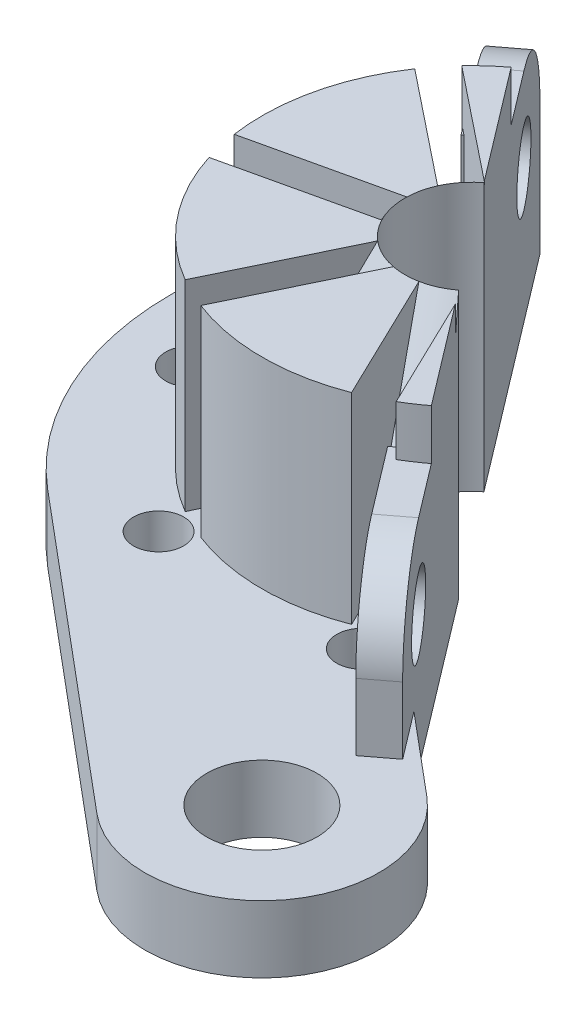
from build123d import *
from build123d.topology import SkipClean

# Parameters (mm, degrees)
SKETCH1_R           = 8.984375
SKETCH1_R_2         = 1.984375
SKETCH1_R_3         = 0.75
BOSS_EXTRUDE1_DEPTH = 2
SKETCH6_W           = 17.96875
SKETCH6_H           = 8
CUT_EXTRUDE1_DEPTH  = 16.014592511
BOSS_EXTRUDE3_START = -2
SKETCH7_R           = 1.65
BOSS_EXTRUDE3_DEPTH = 2
SKETCH8_R           = 1.1
BOSS_EXTRUDE4_DEPTH = 1


with BuildPart() as part:
    # Sketch1 → Boss-Extrude1 (new body)
    with BuildSketch(Plane(origin=(0, 0, 0), x_dir=(1, 0, 0), z_dir=(0, 1, 0))):
        with Locations(Location((0, 0, 0), (0, 0, 270))):
            Circle(SKETCH1_R)
        with Locations(Location((0, 0, 0), (0, 0, 270))):
            Circle(SKETCH1_R_2, mode=Mode.SUBTRACT)
        with Locations(Location((0, 7, 0), (0, 0, 270))):
            Circle(SKETCH1_R_3, mode=Mode.SUBTRACT)
        with Locations(Location((5.472820377, 4.364428613, 0), (0, 0, 270))):
            Circle(SKETCH1_R_3, mode=Mode.SUBTRACT)
        with Locations(Location((6.824495385, -1.557646538, 0), (0, 0, 270))):
            Circle(SKETCH1_R_3, mode=Mode.SUBTRACT)
        with Locations(Location((3.037186174, -6.306782075, 0), (0, 0, 270))):
            Circle(SKETCH1_R_3, mode=Mode.SUBTRACT)
        with Locations(Location((-3.037186174, -6.306782075, 0), (0, 0, 270))):
            Circle(SKETCH1_R_3, mode=Mode.SUBTRACT)
        with Locations(Location((-6.824495385, -1.557646538, 0), (0, 0, 270))):
            Circle(SKETCH1_R_3, mode=Mode.SUBTRACT)
        with Locations(Location((-5.472820377, 4.364428613, 0), (0, 0, 270))):
            Circle(SKETCH1_R_3, mode=Mode.SUBTRACT)
    extrude(amount=BOSS_EXTRUDE1_DEPTH)

    # Sweep1: sweep along a path in Sketch3
    with SkipClean():  # the faces are left unmerged after this step: merging them gives an invalid solid
        with BuildLine(Plane(origin=(0, 0, 0), x_dir=(0, 0, -1), z_dir=(1, 0, 0))) as sweep1_path:
            Line((0, 2), (0, 8))
        # Sketch2 → Sweep1 (sweep)
        with BuildSketch(Plane(origin=(0, 2, 0), x_dir=(1, 0, 0), z_dir=(0, 1, 0))):
            with BuildLine():
                Line((-0.5, 6.229967897), (-0.5, 1.920350005))
                ThreePointArc((-0.5, 1.920350005), (-0.860988045, 1.787860097), (-1.18964519, 1.588234385))
                Line((-1.18964519, 1.588234385), (-4.559040136, 4.275237191))
                ThreePointArc((-4.559040136, 4.275237191), (-2.711773369, 5.631055424), (-0.5, 6.229967897))
            make_face()
            with BuildLine():
                Line((0.5, 6.229967897), (0.5, 1.920350005))
                ThreePointArc((0.5, 1.920350005), (0.860988045, 1.787860097), (1.18964519, 1.588234385))
                Line((1.18964519, 1.588234385), (4.559040136, 4.275237191))
                ThreePointArc((4.559040136, 4.275237191), (2.711773369, 5.631055424), (0.5, 6.229967897))
            make_face()
            with BuildLine():
                Line((5.182529938, 3.493405709), (1.813134992, 0.806402903))
                ThreePointArc((1.813134992, 0.806402903), (1.934622576, 0.441564978), (1.983463288, 0.06014588))
                Line((1.983463288, 0.06014588), (6.185030062, -0.898834319))
                ThreePointArc((6.185030062, -0.898834319), (6.093299451, 1.390755837), (5.182529938, 3.493405709))
            make_face()
            with BuildLine():
                Line((5.962509128, -1.873762231), (1.760942354, -0.914782033))
                ThreePointArc((1.760942354, -0.914782033), (1.551446848, -1.237237576), (1.283693074, -1.5132337))
                Line((1.283693074, -1.5132337), (3.1535662, -5.396065254))
                ThreePointArc((3.1535662, -5.396065254), (4.886446765, -3.896811262), (5.962509128, -1.873762231))
            make_face()
            with BuildLine():
                Line((2.252597332, -5.829948993), (0.382724207, -1.947117439))
                ThreePointArc((0.382724207, -1.947117439), (0, -1.984375), (-0.382724207, -1.947117439))
                Line((-0.382724207, -1.947117439), (-2.252597332, -5.829948993))
                ThreePointArc((-2.252597332, -5.829948993), (0, -6.25), (2.252597332, -5.829948993))
            make_face()
            with BuildLine():
                Line((-3.1535662, -5.396065254), (-1.283693074, -1.5132337))
                ThreePointArc((-1.283693074, -1.5132337), (-1.551446848, -1.237237576), (-1.760942354, -0.914782033))
                Line((-1.760942354, -0.914782033), (-5.962509128, -1.873762231))
                ThreePointArc((-5.962509128, -1.873762231), (-4.886446765, -3.896811262), (-3.1535662, -5.396065254))
            make_face()
            with BuildLine():
                Line((-6.185030062, -0.898834319), (-1.983463288, 0.06014588))
                ThreePointArc((-1.983463288, 0.06014588), (-1.934622576, 0.441564978), (-1.813134992, 0.806402903))
                Line((-1.813134992, 0.806402903), (-5.182529938, 3.493405709))
                ThreePointArc((-5.182529938, 3.493405709), (-6.093299451, 1.390755837), (-6.185030062, -0.898834319))
            make_face()
        sweep(path=sweep1_path.line)

    # Sketch4 → Revolve1 (revolve)
    with SkipClean():  # the faces are left unmerged after this step: merging them gives an invalid solid
        with BuildSketch(Plane(origin=(0, 0, 0), x_dir=(0, 0, -1), z_dir=(1, 0, 0)), mode=Mode.PRIVATE) as revolve1_sk:
            Polygon((-5.396065254, 2), (-1.984375, 2), (-1.984375, 8), align=None)
        revolve(revolve1_sk.sketch.rotate(Axis((0, 0, 0), (0, 1, 0)), 165.405971265), axis=Axis((0, 0, 0), (0, 1, 0)))

    # Sketch6 → Cut-Extrude1 (cut, through all)
    with SkipClean():  # the faces are left unmerged after this step: merging them gives an invalid solid
        with BuildSketch(Plane(origin=(0, 0, 0), x_dir=(0.6052939880428899, 0, 0.7960020025346255), z_dir=(-0.7960020025346255, 0, 0.6052939880428899))):
            with Locations((0, 4)):
                Rectangle(SKETCH6_W, SKETCH6_H)
        extrude(amount=-CUT_EXTRUDE1_DEPTH, mode=Mode.SUBTRACT)

    # Sketch7 → Boss-Extrude3 (add)
    with SkipClean():  # the faces are left unmerged after this step: merging them gives an invalid solid
        with BuildSketch(Plane(origin=(0, 2, 0), x_dir=(1, 0, 0), z_dir=(0, 1, 0)).offset(BOSS_EXTRUDE3_START)):
            with BuildLine():
                Line((5.438188174, -7.151580492), (7.839492164, -9.165791707))
                ThreePointArc((7.839492164, -9.165791707), (8.271761308, -14.096627679), (3.340925335, -14.528896823))
                Line((3.340925335, -14.528896823), (-5.773830193, -6.883449647))
                ThreePointArc((-5.773830193, -6.883449647), (-0.214796249, -8.981806985), (5.438188174, -7.151580492))
            make_face()
            with Locations(Location((5.59020875, -11.847344265, 0), (0, 0, 270))):
                Circle(SKETCH7_R, mode=Mode.SUBTRACT)
        extrude(amount=BOSS_EXTRUDE3_DEPTH)

    # Sketch8 → Boss-Extrude4 (add)
    # profile 1 of 2: a face of its own
    with SkipClean():  # the faces are left unmerged after this step: merging them gives an invalid solid
        with BuildSketch(Plane(origin=(0, 0, 0), x_dir=(-0.60529398804289, 0, -0.7960020025346255), z_dir=(0.7960020025346254, 0, -0.6052939880428899))):
            with BuildLine():
                ThreePointArc((-8.25, 6.5), (-10.017766953, 5.767766953), (-10.75, 4))
                Line((-10.75, 4), (-10.75, 2))
                Line((-10.75, 2), (-5.75, 2))
                Line((-5.75, 2), (-5.75, 6.5))
                Line((-5.75, 6.5), (-8.25, 6.5))
            make_face()
            with Locations((-8.25, 4)):
                Circle(SKETCH8_R, mode=Mode.SUBTRACT)
        # profile 2 of 2: a face of its own
        with BuildSketch(Plane(origin=(0, 0, 0), x_dir=(-0.60529398804289, 0, -0.7960020025346255), z_dir=(0.7960020025346254, 0, -0.6052939880428899))):
            with BuildLine():
                Line((5.75, 2), (8.484375, 2))
                Line((8.484375, 2), (8.484375, 0))
                Line((8.484375, 0), (10.75, 0))
                Line((10.75, 0), (10.75, 4))
                ThreePointArc((10.75, 4), (10.017766953, 5.767766953), (8.25, 6.5))
                Line((8.25, 6.5), (5.75, 6.5))
                Line((5.75, 6.5), (5.75, 2))
            make_face()
            with Locations((8.25, 4)):
                Circle(SKETCH8_R, mode=Mode.SUBTRACT)
        extrude(amount=-BOSS_EXTRUDE4_DEPTH)


solid = part.part
